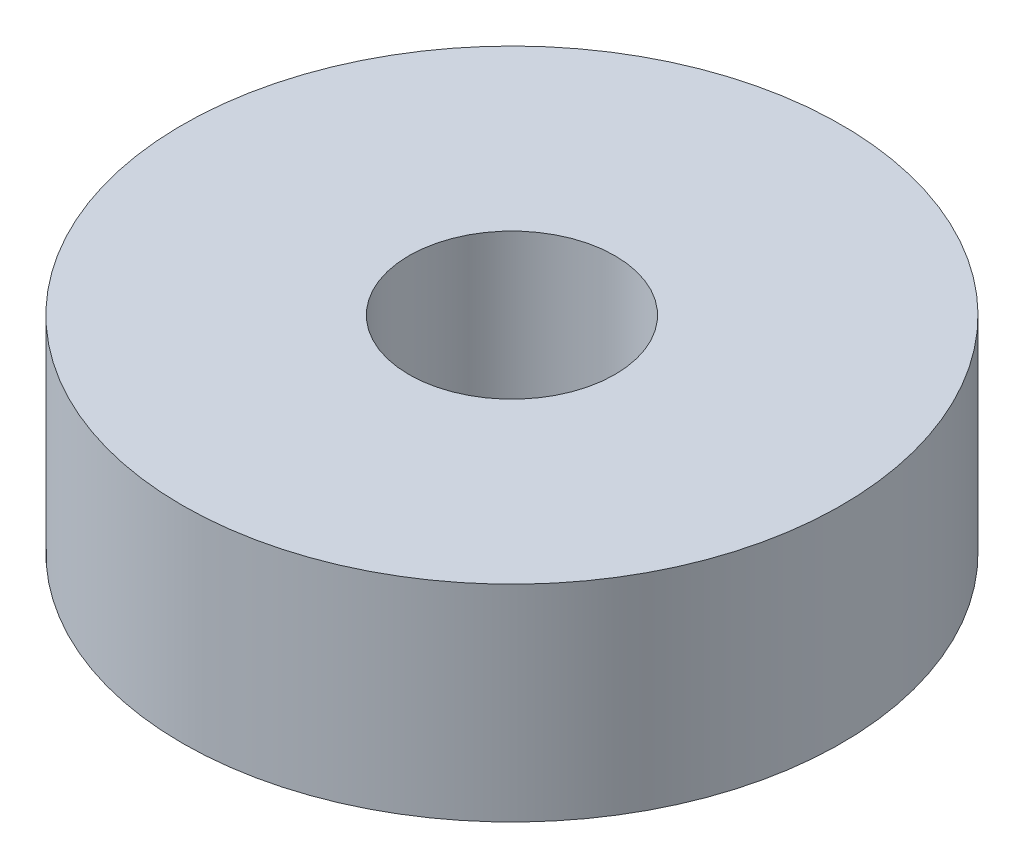
from build123d import *

# Parameters (mm, degrees)
SKETCH1_R   = 8
SKETCH1_R_2 = 2.5
BODY_DEPTH  = 5


with BuildPart() as part:
    # Sketch1 → Body (new body)
    with BuildSketch(Plane(origin=(0, 0, 0), x_dir=(1, 0, 0), z_dir=(0, 1, 0))):
        with Locations(Location((0, 0, 0), (0, 0, 270))):
            Circle(SKETCH1_R)
        with Locations(Location((0, 0, 0), (0, 0, 270))):
            Circle(SKETCH1_R_2, mode=Mode.SUBTRACT)
    extrude(amount=BODY_DEPTH)


solid = part.part
